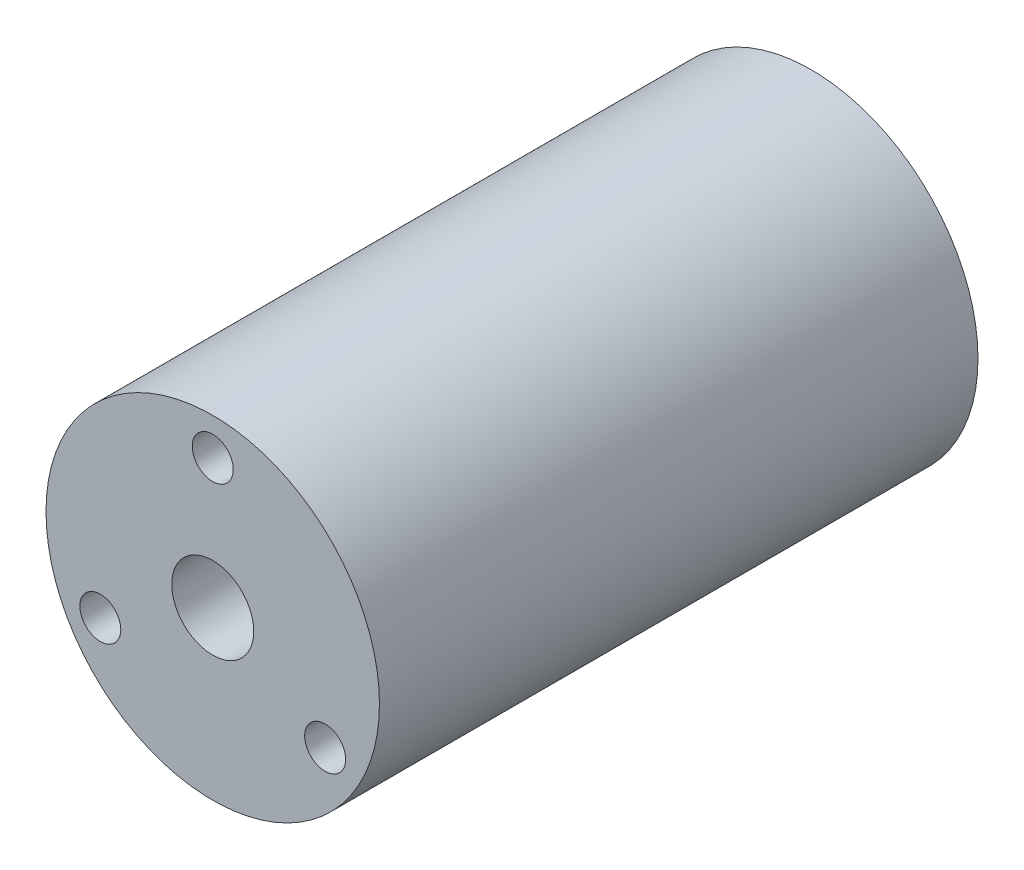
from build123d import *

# Parameters (mm, degrees)
SKETCH_1_R               = 12.2
SKETCH_1_R_2             = 3
EXTRUDE_1_DEPTH          = 43.8
SKETCH_2_R               = 1.5
CUT_EXTRUDE_1_DEPTH      = 5.5
PATTERN_CIRCULAR_2_COUNT = 3


with BuildPart() as part:
    # 草图1 → 凸台-拉伸1 (new body)
    with BuildSketch(Plane.XY):
        Circle(SKETCH_1_R)
        Circle(SKETCH_1_R_2, mode=Mode.SUBTRACT)
    extrude(amount=-EXTRUDE_1_DEPTH)

    # 草图2 → 切除-拉伸1 (cut)
    with BuildSketch(Plane.XY):
        with Locations((0, 9.5)):
            Circle(SKETCH_2_R)
    cut_extrude_1 = extrude(amount=-CUT_EXTRUDE_1_DEPTH, mode=Mode.SUBTRACT)

    # 阵列(圆周)2: 切除-拉伸1 ×3 about axis
    pattern_circular_2_axis = Axis((0, 0, -43.8), (0, 0, 1))
    for i in range(1, PATTERN_CIRCULAR_2_COUNT):
        add(cut_extrude_1.rotate(pattern_circular_2_axis, i * 360 / PATTERN_CIRCULAR_2_COUNT), mode=Mode.SUBTRACT)


solid = part.part
